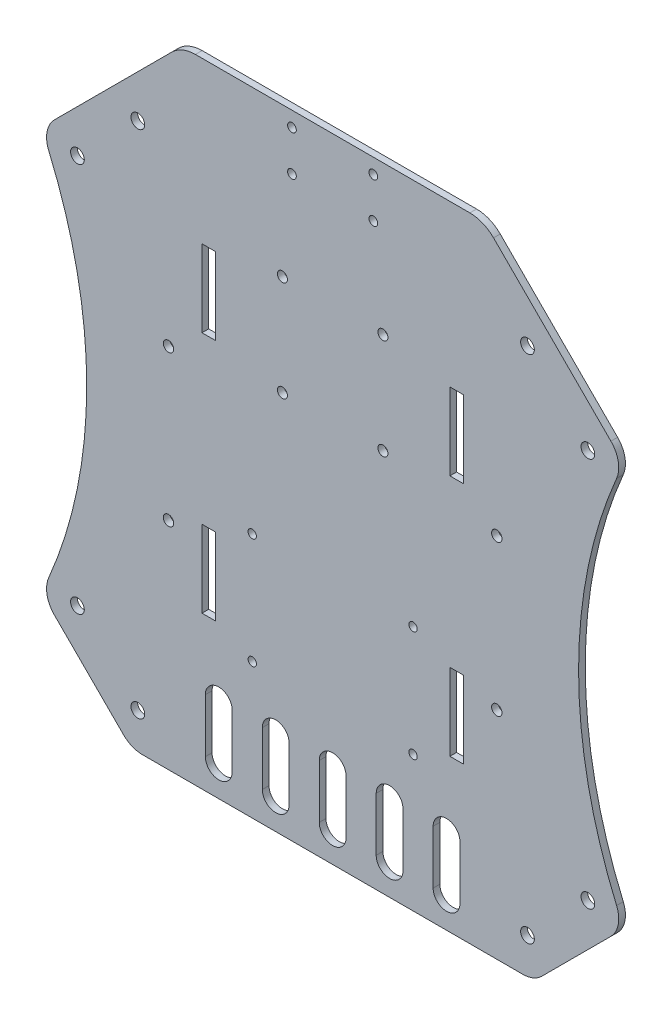
from build123d import *

# Parameters (mm, degrees)
SKETCH1_R           = 1.5
SKETCH1_R_2         = 1.25
SKETCH1_R_3         = 2.05
SKETCH1_W           = 4
SKETCH1_H           = 23
BOSS_EXTRUDE1_DEPTH = 2
FILLET7_R           = 8
BOSS_EXTRUDE2_DEPTH = 2
FILLET8_R           = 10
SKETCH5_R           = 1.55
CUT_EXTRUDE1_DEPTH  = 10
CUT_EXTRUDE2_DEPTH  = 10
SKETCH8_R           = 1.3
CUT_EXTRUDE4_DEPTH  = 10


with BuildPart() as part:
    # Sketch1 → Boss-Extrude1 (new body)
    with BuildSketch(Plane.XY):
        with BuildLine():
            Line((-86.974134086, 60.104076401), (-60.104076401, 86.974134086))
            Line((-60.104076401, 86.974134086), (60.104076401, 86.974134086))
            Line((60.104076401, 86.974134086), (86.974134086, 60.104076401))
            ThreePointArc((86.974134086, 60.104076401), (73.41582025, 0), (86.974134086, -60.104076401))
            Line((86.974134086, -60.104076401), (60.104076401, -86.974134086))
            Line((60.104076401, -86.974134086), (-60.104076401, -86.974134086))
            Line((-60.104076401, -86.974134086), (-86.974134086, -60.104076401))
            ThreePointArc((-86.974134086, -60.104076401), (-73.41582025, 0), (-86.974134086, 60.104076401))
        make_face()
        with Locations((-15, 57.5)):
            Circle(SKETCH1_R, mode=Mode.SUBTRACT)
        with Locations((-15, 27.5)):
            Circle(SKETCH1_R, mode=Mode.SUBTRACT)
        with Locations((15, 27.5)):
            Circle(SKETCH1_R, mode=Mode.SUBTRACT)
        with Locations((15, 57.5)):
            Circle(SKETCH1_R, mode=Mode.SUBTRACT)
        with Locations((-24, -13.5)):
            Circle(SKETCH1_R_2, mode=Mode.SUBTRACT)
        with Locations((24, -13.5)):
            Circle(SKETCH1_R_2, mode=Mode.SUBTRACT)
        with Locations((24, -46.5)):
            Circle(SKETCH1_R_2, mode=Mode.SUBTRACT)
        with Locations((-24, -46.5)):
            Circle(SKETCH1_R_2, mode=Mode.SUBTRACT)
        with Locations((-76.190755673, 58.159532753)):
            Circle(SKETCH1_R_3, mode=Mode.SUBTRACT)
        with Locations((-58.159532753, 76.190755673)):
            Circle(SKETCH1_R_3, mode=Mode.SUBTRACT)
        with Locations((76.190755673, -58.159532753)):
            Circle(SKETCH1_R_3, mode=Mode.SUBTRACT)
        with Locations((58.159532753, -76.190755673)):
            Circle(SKETCH1_R_3, mode=Mode.SUBTRACT)
        with Locations((-58.159532753, -76.190755673)):
            Circle(SKETCH1_R_3, mode=Mode.SUBTRACT)
        with Locations((-76.190755673, -58.159532753)):
            Circle(SKETCH1_R_3, mode=Mode.SUBTRACT)
        with Locations((58.159532753, 76.190755673)):
            Circle(SKETCH1_R_3, mode=Mode.SUBTRACT)
        with Locations((76.190755673, 58.159532753)):
            Circle(SKETCH1_R_3, mode=Mode.SUBTRACT)
        with Locations((-37, 42.5)):
            Rectangle(SKETCH1_W, SKETCH1_H, mode=Mode.SUBTRACT)
        with Locations((37, 42.5)):
            Rectangle(SKETCH1_W, SKETCH1_H, mode=Mode.SUBTRACT)
        with Locations((37, -30)):
            Rectangle(SKETCH1_W, SKETCH1_H, mode=Mode.SUBTRACT)
        with Locations((-37, -30)):
            Rectangle(SKETCH1_W, SKETCH1_H, mode=Mode.SUBTRACT)
    extrude(amount=BOSS_EXTRUDE1_DEPTH)

    # Fillet7
    fillet7_edges = [part.edges().sort_by_distance(p)[0] for p in [
        (86.974134086, -60.104076401, 1),
        (60.104076401, -86.974134086, 1),
        (-60.104076401, -86.974134086, 1),
        (-86.974134086, -60.104076401, 1),
        (-86.974134086, 60.104076401, 1),
        (-60.104076401, 86.974134086, 1),
        (60.104076401, 86.974134086, 1),
        (86.974134086, 60.104076401, 1),
    ]]
    fillet(fillet7_edges, radius=FILLET7_R)

    # Sketch2 → Boss-Extrude2 (add)
    with BuildSketch(Plane.XY.offset(2)):
        with BuildLine():
            Line((-62.447222151, 84.630988335), (-45.104076401, 101.974134086))
            Line((-45.104076401, 101.974134086), (45.104076401, 101.974134086))
            Line((45.104076401, 101.974134086), (62.447222151, 84.630988335))
            ThreePointArc((62.447222151, 84.630988335), (59.851835361, 86.365170346), (56.790367902, 86.974134086))
            Line((56.790367902, 86.974134086), (-56.790367902, 86.974134086))
            ThreePointArc((-56.790367902, 86.974134086), (-59.851835361, 86.365170346), (-62.447222151, 84.630988335))
        make_face()
    extrude(amount=-BOSS_EXTRUDE2_DEPTH)

    # Fillet8
    fillet8_edges = [part.edges().sort_by_distance(p)[0] for p in [
        (-45.104076401, 101.974134086, 1),
        (45.104076401, 101.974134086, 1),
    ]]
    fillet(fillet8_edges, radius=FILLET8_R)

    # Sketch5 → Cut-Extrude1 (cut)
    with BuildSketch(Plane.XY.offset(2)):
        with Locations((49, 22.5)):
            Circle(SKETCH5_R)
        with Locations((49, -22.5)):
            Circle(SKETCH5_R)
        with Locations((-49, -22.5)):
            Circle(SKETCH5_R)
        with Locations((-49, 22.5)):
            Circle(SKETCH5_R)
    extrude(amount=-CUT_EXTRUDE1_DEPTH, mode=Mode.SUBTRACT)

    # Sketch6 → Cut-Extrude2 (cut)
    with BuildSketch(Plane.XY.offset(2)):
        with BuildLine():
            Line((-30, -62.074134086), (-30, -78.074134086))
            ThreePointArc((-30, -78.074134086), (-34, -82.074134086), (-38, -78.074134086))
            Line((-38, -78.074134086), (-38, -62.074134086))
            ThreePointArc((-38, -62.074134086), (-34, -58.074134086), (-30, -62.074134086))
        make_face()
        with BuildLine():
            Line((-13, -62.074134086), (-13, -78.074134086))
            ThreePointArc((-13, -78.074134086), (-17, -82.074134086), (-21, -78.074134086))
            Line((-21, -78.074134086), (-21, -62.074134086))
            ThreePointArc((-21, -62.074134086), (-17, -58.074134086), (-13, -62.074134086))
        make_face()
        with BuildLine():
            Line((4, -62.074134086), (4, -78.074134086))
            ThreePointArc((4, -78.074134086), (0, -82.074134086), (-4, -78.074134086))
            Line((-4, -78.074134086), (-4, -62.074134086))
            ThreePointArc((-4, -62.074134086), (0, -58.074134086), (4, -62.074134086))
        make_face()
        with BuildLine():
            Line((21, -62.074134086), (21, -78.074134086))
            ThreePointArc((21, -78.074134086), (17, -82.074134086), (13, -78.074134086))
            Line((13, -78.074134086), (13, -62.074134086))
            ThreePointArc((13, -62.074134086), (17, -58.074134086), (21, -62.074134086))
        make_face()
        with BuildLine():
            Line((38, -62.074134086), (38, -78.074134086))
            ThreePointArc((38, -78.074134086), (34, -82.074134086), (30, -78.074134086))
            Line((30, -78.074134086), (30, -62.074134086))
            ThreePointArc((30, -62.074134086), (34, -58.074134086), (38, -62.074134086))
        make_face()
    extrude(amount=-CUT_EXTRUDE2_DEPTH, mode=Mode.SUBTRACT)

    # Sketch8 → Cut-Extrude4 (cut)
    with BuildSketch(Plane.XY.offset(2)):
        with Locations((12.15, 97.474134086)):
            Circle(SKETCH8_R)
        with Locations((12.15, 85.474134086)):
            Circle(SKETCH8_R)
        with Locations((-12.15, 85.474134086)):
            Circle(SKETCH8_R)
        with Locations((-12.15, 97.474134086)):
            Circle(SKETCH8_R)
    extrude(amount=-CUT_EXTRUDE4_DEPTH, mode=Mode.SUBTRACT)


solid = part.part
